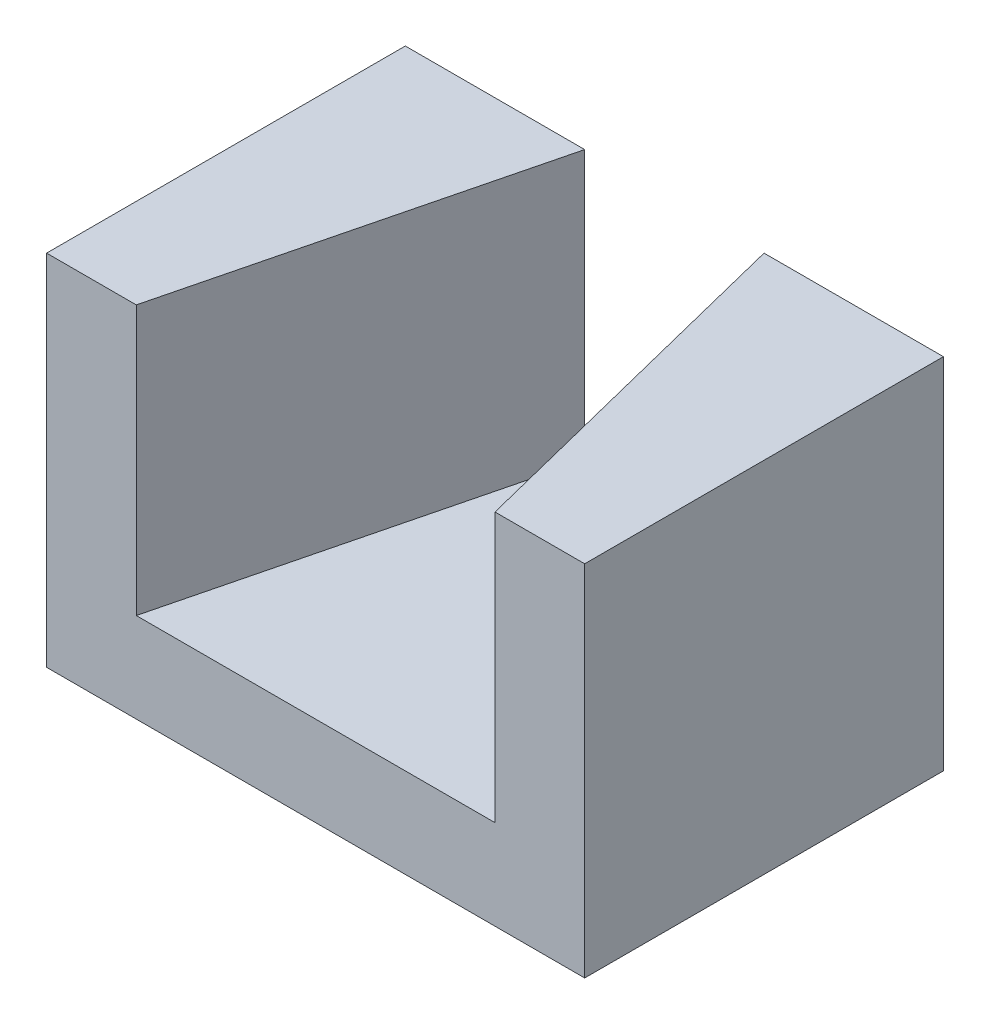
from build123d import *

# Parameters (mm, degrees)
SKETCH1_W           = 60
SKETCH1_H           = 40
BOSS_EXTRUDE1_DEPTH = 40
CUT_EXTRUDE1_DEPTH  = 30


with BuildPart() as part:
    # Sketch1 → Boss-Extrude1 (new body)
    with BuildSketch(Plane(origin=(0, 0, 0), x_dir=(1, 0, 0), z_dir=(0, 1, 0))):
        Rectangle(SKETCH1_W, SKETCH1_H)
    extrude(amount=BOSS_EXTRUDE1_DEPTH)

    # Sketch2 → Cut-Extrude1 (cut)
    with BuildSketch(Plane(origin=(0, 40, 0), x_dir=(1, 0, 0), z_dir=(0, 1, 0))):
        Polygon((-10, 20), (10, 20), (20, -20), (-20, -20), align=None)
    extrude(amount=-CUT_EXTRUDE1_DEPTH, mode=Mode.SUBTRACT)


solid = part.part
